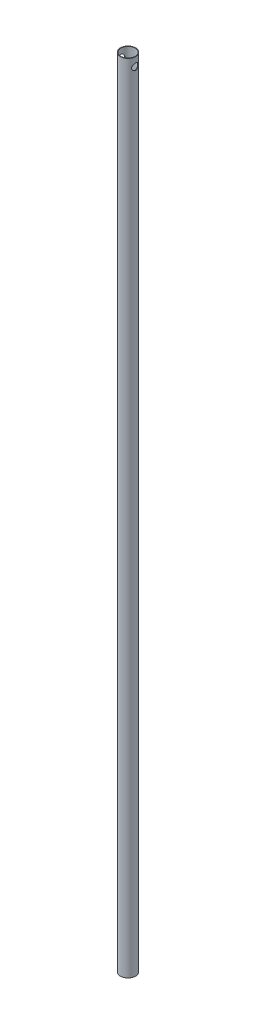
from build123d import *

# Parameters (mm, degrees)
SKETCH1_R               = 17.46
SKETCH1_R_2             = 16.46
BOSS_EXTRUDE1_DEPTH     = 1828.8
CUT_EXTRUDE1_DEPTH      = 1829.966687285
CUT_EXTRUDE1_DEPTH_BACK = 1829.966687285
SKETCH2_R               = 7.5


with BuildPart() as part:
    # Sketch1 → Boss-Extrude1 (new body)
    with BuildSketch(Plane(origin=(0, 0, 0), x_dir=(1, 0, 0), z_dir=(0, 1, 0))):
        with Locations(Location((0, 0, 0), (0, 0, 90))):
            Circle(SKETCH1_R)
        with Locations(Location((0, 0, 0), (0, 0, 90))):
            Circle(SKETCH1_R_2, mode=Mode.SUBTRACT)
    extrude(amount=BOSS_EXTRUDE1_DEPTH)

    # Sketch2 → Cut-Extrude1 (cut, two sides: drawn at the far end of the back side and taken through both)
    with BuildSketch(Plane(origin=(0, 0, 0), x_dir=(0, 0, -1), z_dir=(1, 0, 0)).offset(-CUT_EXTRUDE1_DEPTH_BACK)):
        with Locations((0, 1808.8)):
            Circle(SKETCH2_R)
    extrude(amount=CUT_EXTRUDE1_DEPTH + CUT_EXTRUDE1_DEPTH_BACK, mode=Mode.SUBTRACT)


solid = part.part
